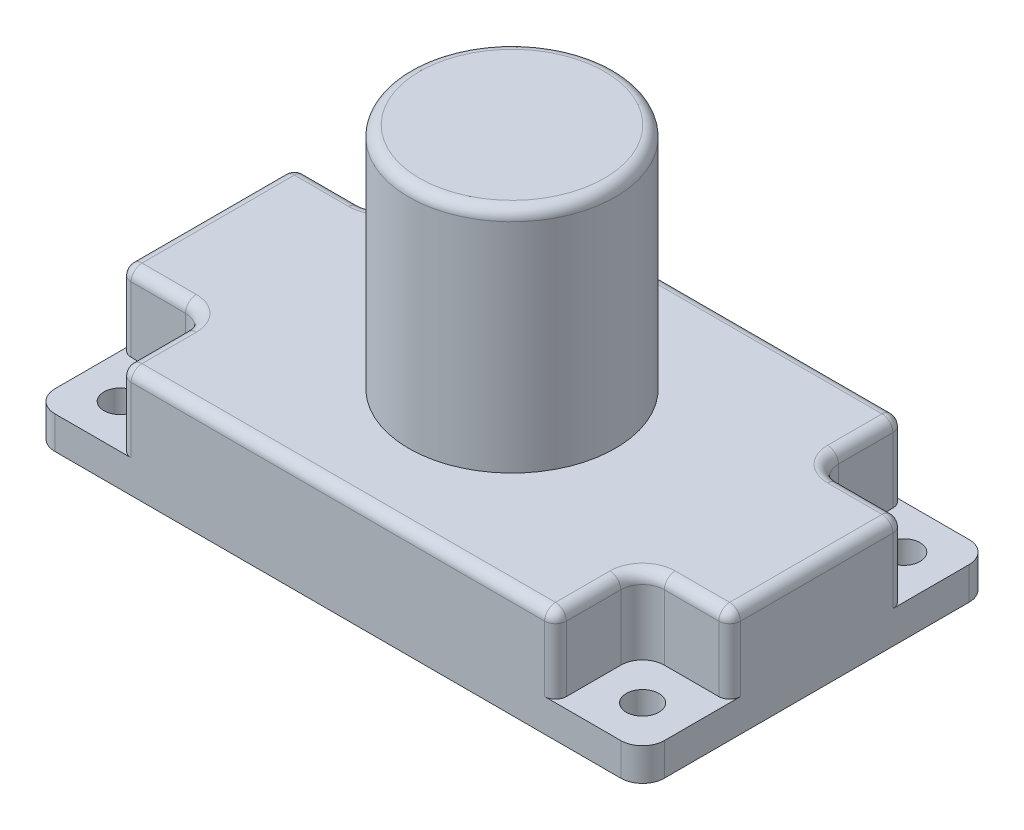
from build123d import *

# Parameters (mm, degrees)
CROQUIS1_W              = 56
CROQUIS1_H              = 32
SALIENTE_EXTRUIR1_DEPTH = 10
CROQUIS2_R              = 9.5
SALIENTE_EXTRUIR2_DEPTH = 21
CROQUIS3_W              = 8
CROQUIS3_H              = 8
CORTAR_EXTRUIR1_DEPTH   = 7
CROQUIS4_R              = 1.5
CORTAR_EXTRUIR2_DEPTH   = 71.313583325
REDONDEO1_R             = 2
REDONDEO2_R             = 1
REDONDEO3_R             = 1
REDONDEO4_R             = 1


with BuildPart() as part:
    # Croquis1 → Saliente-Extruir1 (new body)
    with BuildSketch(Plane(origin=(0, 0, 0), x_dir=(1, 0, 0), z_dir=(0, 1, 0))):
        with Locations((28, -16)):
            Rectangle(CROQUIS1_W, CROQUIS1_H)
    extrude(amount=SALIENTE_EXTRUIR1_DEPTH)

    # Croquis2 → Saliente-Extruir2 (add)
    with BuildSketch(Plane(origin=(0, 10, 0), x_dir=(1, 0, 0), z_dir=(0, 1, 0))):
        with Locations(Location((28, -16, 0), (0, 0, 90))):
            Circle(CROQUIS2_R)
    extrude(amount=SALIENTE_EXTRUIR2_DEPTH)

    # Croquis3 → Cortar-Extruir1 (cut)
    with BuildSketch(Plane(origin=(0, 10, 0), x_dir=(1, 0, 0), z_dir=(0, 1, 0))):
        with Locations((52, -28)):
            Rectangle(CROQUIS3_W, CROQUIS3_H)
        with Locations((52, -4)):
            Rectangle(CROQUIS3_W, CROQUIS3_H)
        with Locations((4, -4)):
            Rectangle(CROQUIS3_W, CROQUIS3_H)
        with Locations((4, -28)):
            Rectangle(CROQUIS3_W, CROQUIS3_H)
    extrude(amount=-CORTAR_EXTRUIR1_DEPTH, mode=Mode.SUBTRACT)

    # Croquis4 → Cortar-Extruir2 (cut, through all)
    with BuildSketch(Plane(origin=(0, 3, 0), x_dir=(1, 0, 0), z_dir=(0, 1, 0))):
        with Locations(Location((4, -4, 0), (0, 0, 270))):
            Circle(CROQUIS4_R)
        with Locations(Location((4, -28, 0), (0, 0, 270))):
            Circle(CROQUIS4_R)
        with Locations(Location((52, -28, 0), (0, 0, 270))):
            Circle(CROQUIS4_R)
        with Locations(Location((52, -4, 0), (0, 0, 270))):
            Circle(CROQUIS4_R)
    extrude(amount=-CORTAR_EXTRUIR2_DEPTH, mode=Mode.SUBTRACT)

    # Redondeo1
    redondeo1_edges = [part.edges().sort_by_distance(p)[0] for p in [
        (0, 1.5, 0),
        (56, 1.5, 0),
        (56, 1.5, 32),
        (0, 1.5, 32),
        (8, 6.5, 24),
        (8, 6.5, 8),
        (48, 6.5, 8),
        (48, 6.5, 24),
    ]]
    fillet(redondeo1_edges, radius=REDONDEO1_R)

    # Redondeo2
    redondeo2_edges = [part.edges().sort_by_distance(p)[0] for p in [
        (0, 10, 16),
        (28, 10, 32),
        (56, 10, 16),
        (28, 10, 0),
    ]]
    fillet(redondeo2_edges, radius=REDONDEO2_R)

    # Redondeo3
    redondeo3_edges = [part.edges().sort_by_distance(p)[0] for p in [
        (48, 10, 28.5),
        (8, 10, 3.5),
        (3.5, 10, 24),
        (48.585786438, 10, 7.414213562),
        (48.585786438, 10, 24.585786438),
        (7.414213562, 10, 7.414213562),
        (7.414213562, 10, 24.585786438),
        (8, 10, 28.5),
        (52.5, 10, 24),
        (48, 10, 3.5),
        (3.5, 10, 8),
        (0.292893219, 9.707106781, 24),
        (0.292893219, 9.707106781, 8),
        (8, 9.707106781, 0.292893219),
        (48, 9.707106781, 0.292893219),
        (55.707106781, 9.707106781, 8),
        (55.707106781, 9.707106781, 24),
        (48, 9.707106781, 31.707106781),
        (8, 9.707106781, 31.707106781),
        (8, 6, 32),
        (0, 6, 24),
        (0, 6, 8),
        (8, 6, 0),
        (48, 6, 0),
        (56, 6, 8),
        (48, 6, 32),
        (56, 6, 24),
        (52.5, 10, 8),
    ]]
    fillet(redondeo3_edges, radius=REDONDEO3_R)

    # Redondeo4
    redondeo4_edges = [part.edges().sort_by_distance(p)[0] for p in [
        (28, 31, 25.5),
    ]]
    fillet(redondeo4_edges, radius=REDONDEO4_R)


solid = part.part
